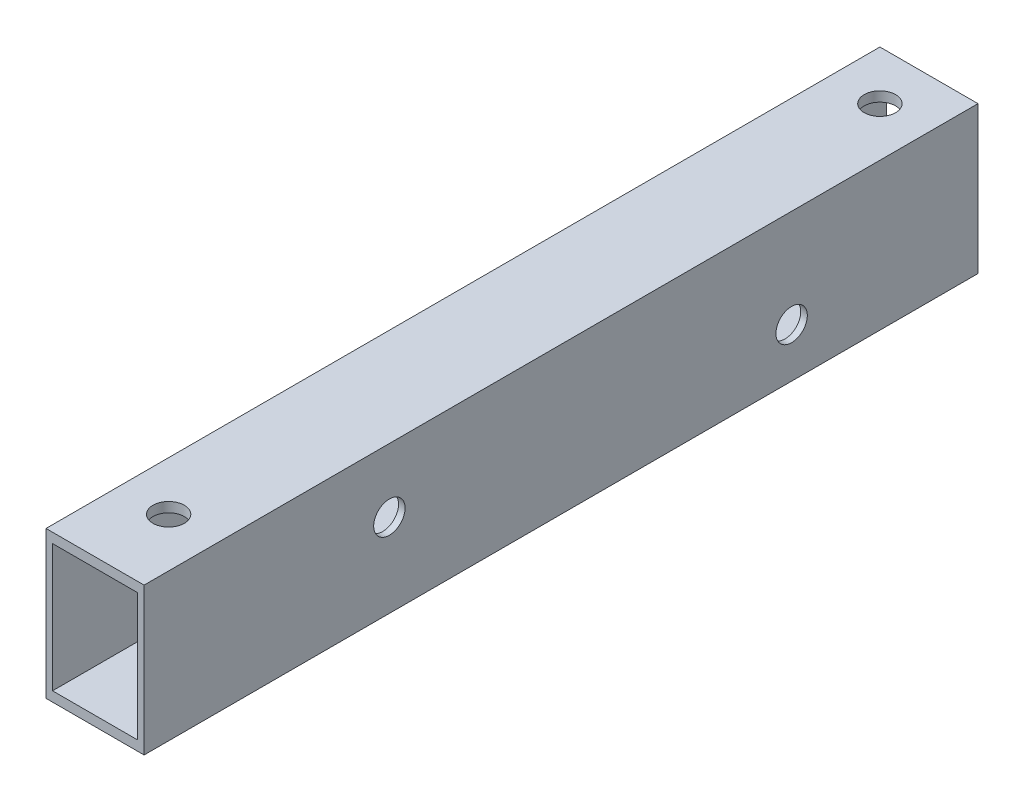
from build123d import *

# Parameters (mm, degrees)
SKETCH_1_W          = 10
SKETCH_1_H          = 15
SKETCH_1_W_2        = 8.666666666
SKETCH_1_H_2        = 13
EXTRUDE_1_DEPTH     = 85
SKETCH_3_R          = 1.6
CUT_EXTRUDE_2_DEPTH = 87.458082329
SKETCH_4_R          = 1.6
CUT_EXTRUDE_3_DEPTH = 86.914201387


with BuildPart() as part:
    # ｽｹｯﾁ1 → ﾎﾞｽ - 押し出し1 (new body)
    with BuildSketch(Plane.XY):
        Rectangle(SKETCH_1_W, SKETCH_1_H)
        Rectangle(SKETCH_1_W_2, SKETCH_1_H_2, mode=Mode.SUBTRACT)
    extrude(amount=EXTRUDE_1_DEPTH)

    # ｽｹｯﾁ3 → ｶｯﾄ - 押し出し2 (cut, through all)
    with BuildSketch(Plane(origin=(0, 7.5, 0), x_dir=(1, 0, 0), z_dir=(0, 1, 0))):
        with Locations(Location((0, -77.5, 0), (0, 0, 270))):
            Circle(SKETCH_3_R)
        with Locations(Location((0, -5, 0), (0, 0, 270))):
            Circle(SKETCH_3_R)
    extrude(amount=-CUT_EXTRUDE_2_DEPTH, mode=Mode.SUBTRACT)

    # ｽｹｯﾁ4 → ｶｯﾄ - 押し出し3 (cut, through all)
    with BuildSketch(Plane.ZY.offset(5)):
        with Locations((60, 1)):
            Circle(SKETCH_4_R)
        with Locations((19, -2.5)):
            Circle(SKETCH_4_R)
    extrude(amount=-CUT_EXTRUDE_3_DEPTH, mode=Mode.SUBTRACT)


solid = part.part
